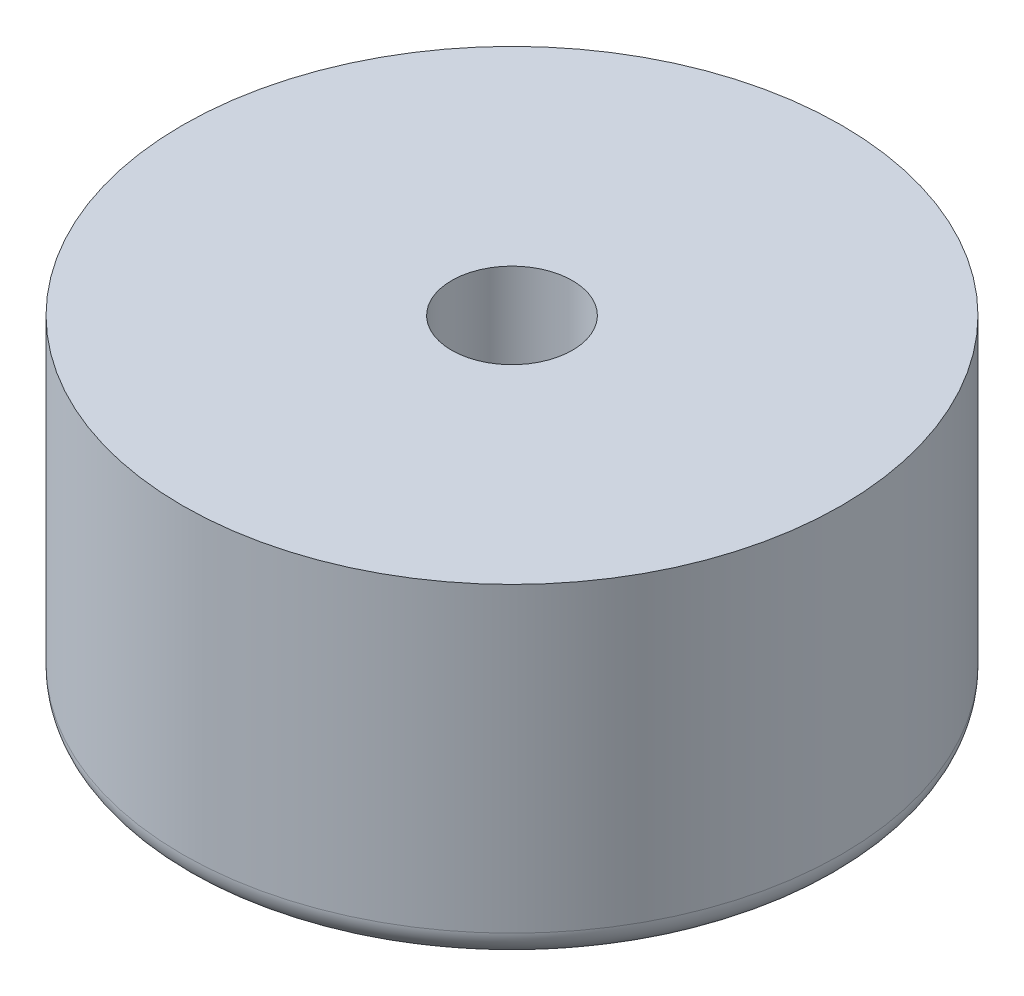
from build123d import *

# Parameters (mm, degrees)
SKETCH1_R           = 6
BOSS_EXTRUDE1_DEPTH = 6
SKETCH2_R           = 1.1
CUT_EXTRUDE1_DEPTH  = 4.3
FILLET1_R           = 0.5


with BuildPart() as part:
    # Sketch1 → Boss-Extrude1 (new body)
    with BuildSketch(Plane(origin=(0, 0, 0), x_dir=(1, 0, 0), z_dir=(0, 1, 0))):
        with Locations(Location((0, 0, 0), (0, 0, 270))):
            Circle(SKETCH1_R)
    extrude(amount=BOSS_EXTRUDE1_DEPTH)

    # Sketch2 → Cut-Extrude1 (cut)
    with BuildSketch(Plane(origin=(0, 6, 0), x_dir=(1, 0, 0), z_dir=(0, 1, 0))):
        with Locations(Location((0, 0, 0), (0, 0, 270))):
            Circle(SKETCH2_R)
    extrude(amount=-CUT_EXTRUDE1_DEPTH, mode=Mode.SUBTRACT)

    # Fillet1
    fillet1_edges = [part.edges().sort_by_distance(p)[0] for p in [
        (0, 0, -6),
    ]]
    fillet(fillet1_edges, radius=FILLET1_R)


solid = part.part
